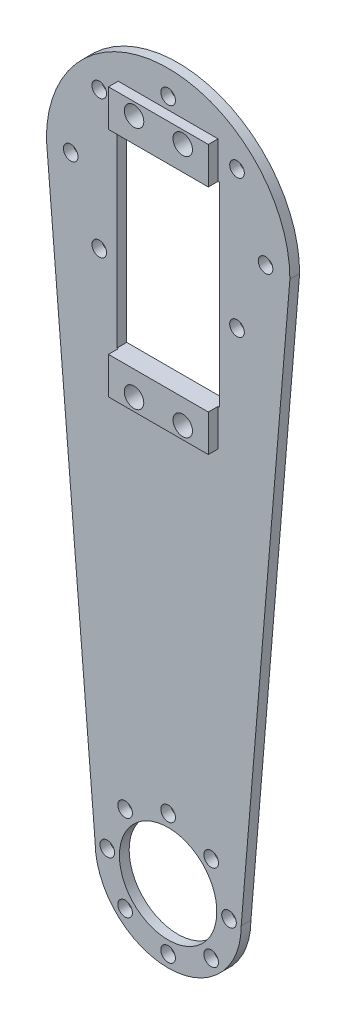
from build123d import *

# Parameters (mm, degrees)
SKETCH_1_W          = 20.5
SKETCH_1_H          = 15.141704846
SKETCH_1_R          = 2
EXTRUDE_1_DEPTH     = 29
SKETCH_2_W          = 20.5
SKETCH_2_H          = 70.283409692
EXTRUDE_2_DEPTH     = 3
SKETCH_3_W          = 20.5
SKETCH_3_H          = 7.570852423
CUT_EXTRUDE_1_DEPTH = 49.621002864
SKETCH_5_R          = 2.5
EXTRUDE_3_DEPTH     = 10
CUT_EXTRUDE_2_REACH = 75.297
SKETCH_8_R          = 1.6
SKETCH_9_W          = 20.5
SKETCH_9_H          = 55.141704846
CUT_EXTRUDE_3_DEPTH = 30
SKETCH_11_R         = 2.5
CUT_EXTRUDE_4_DEPTH = 10
SKETCH_12_W         = 21
SKETCH_12_H         = 40
SKETCH_12_R         = 2
EXTRUDE_5_DEPTH     = 2
SKETCH_13_R         = 10
CUT_EXTRUDE_5_DEPTH = 2
SKETCH_14_R         = 1.5
CUT_EXTRUDE_6_DEPTH = 128.538229563


with BuildPart() as part:
    # 草图1 → 凸台-拉伸1 (new body)
    # profile 1 of 3: a face of its own
    with BuildSketch(Plane.XY):
        with BuildLine():
            Line((-10.25, 35.141704846), (-10.25, 20))
            Line((-10.25, 20), (-5, 20))
            Line((-5, 20), (-5, 23))
            ThreePointArc((-5, 23), (-6.414213562, 26.414213562), (-3, 25))
            Line((-3, 25), (3, 25))
            ThreePointArc((3, 25), (5, 27), (7, 25))
            ThreePointArc((7, 25), (6.414213562, 23.585786438), (5, 23))
            Line((5, 23), (5, 20))
            Line((5, 20), (10.25, 20))
            Line((10.25, 20), (10.25, 35.141704846))
            Line((10.25, 35.141704846), (-10.25, 35.141704846))
        make_face()
    # profile 2 of 3: a face of its own
    with BuildSketch(Plane.XY):
        with Locations((0, -27.570852423)):
            Rectangle(SKETCH_1_W, SKETCH_1_H)
        with Locations(Location((-5, -25, 0), (0, 0, 180))):
            Circle(SKETCH_1_R, mode=Mode.SUBTRACT)
        with Locations(Location((5, -25, 0), (0, 0, 180))):
            Circle(SKETCH_1_R, mode=Mode.SUBTRACT)
    # profile 3 of 3: a face of its own
    with BuildSketch(Plane.XY):
        with BuildLine():
            Line((-5, 23), (-5, 20))
            Line((-5, 20), (5, 20))
            Line((5, 20), (5, 23))
            ThreePointArc((5, 23), (3.585786438, 23.585786438), (3, 25))
            Line((3, 25), (-3, 25))
            ThreePointArc((-3, 25), (-3.585786438, 23.585786438), (-5, 23))
        make_face()
    extrude(amount=EXTRUDE_1_DEPTH)

    # 草图2 → 凸台-拉伸2 (add)
    with BuildSketch(Plane.XY.offset(29)):
        Rectangle(SKETCH_2_W, SKETCH_2_H)
    extrude(amount=EXTRUDE_2_DEPTH)

    # 草图3 → 切除-拉伸1 (cut, through all)
    with BuildSketch(Plane(origin=(0, 0, 0), x_dir=(-1, 0, 0), z_dir=(0, 0, -1))):
        with Locations((0, -31.356278635)):
            Rectangle(SKETCH_3_W, SKETCH_3_H)
        with Locations((0, 31.356278635)):
            Rectangle(SKETCH_3_W, SKETCH_3_H)
    extrude(amount=-CUT_EXTRUDE_1_DEPTH, mode=Mode.SUBTRACT)

    # 草图5 → 凸台-拉伸3 (add)
    with BuildSketch(Plane.XZ.offset(27.570852423)):
        with Locations(Location((0, 2.5, 0), (0, 0, 270))):
            Circle(SKETCH_5_R)
    extrude(amount=EXTRUDE_3_DEPTH)

    # 草图8 → 切除-拉伸2 (cut, up to next)
    with BuildSketch(Plane(origin=(0, 27.570852423, 0), x_dir=(1, 0, 0), z_dir=(0, 1, 0)), mode=Mode.PRIVATE) as cut_extrude_2_sk1:
        with Locations(Location((0, -16.5, 0), (0, 0, 270))):
            Circle(SKETCH_8_R)
    cut_extrude_2_tool1 = extrude(cut_extrude_2_sk1.sketch, amount=-CUT_EXTRUDE_2_REACH, mode=Mode.PRIVATE) & part.part
    # 草图8 → 切除-拉伸2 (cut, up to next)
    with BuildSketch(Plane(origin=(0, 27.570852423, 0), x_dir=(1, 0, 0), z_dir=(0, 1, 0)), mode=Mode.PRIVATE) as cut_extrude_2_sk2:
        with Locations(Location((0, -26.5, 0), (0, 0, 270))):
            Circle(SKETCH_8_R)
    cut_extrude_2_tool2 = extrude(cut_extrude_2_sk2.sketch, amount=-CUT_EXTRUDE_2_REACH, mode=Mode.PRIVATE) & part.part
    add(cut_extrude_2_tool1.solids().sort_by_distance((0, 27.570852, 16.5))[0], mode=Mode.SUBTRACT)
    add(cut_extrude_2_tool2.solids().sort_by_distance((0, 27.570852, 26.5))[0], mode=Mode.SUBTRACT)

    # 草图9 → 切除-拉伸3 (cut)
    with BuildSketch(Plane.XY.offset(32)):
        Rectangle(SKETCH_9_W, SKETCH_9_H)
    extrude(amount=-CUT_EXTRUDE_3_DEPTH, mode=Mode.SUBTRACT)


with BuildPart() as cut_extrude_3_piece_1:
    # of the separate pieces the step leaves, piece 1, a body of its own (cut_extrude_3_pieces)
    add(part.part.solids().sort_by_distance((10.25, -20, 2))[0])

    # 草图11 → 切除-拉伸4 (cut)
    with BuildSketch(Plane.XZ.offset(37.570852423)):
        with Locations((0, 2.5)):
            Circle(SKETCH_11_R)
    extrude(amount=-CUT_EXTRUDE_4_DEPTH, mode=Mode.SUBTRACT)



with BuildPart() as cut_extrude_3_piece_2:
    # of the separate pieces the step leaves, piece 2, a body of its own (cut_extrude_3_pieces)
    add(part.part.solids().sort_by_distance((10.25, 20, 0))[0])


with BuildPart() as cut_extrude_3_piece_1_1:
    add(cut_extrude_3_piece_1.part)

    add(cut_extrude_3_piece_2.part)  # 凸台-拉伸5 merges 切除-拉伸3 piece 2
    # 草图12 → 凸台-拉伸5 (add)
    with BuildSketch(Plane(origin=(0, 0, 0), x_dir=(-1, 0, 0), z_dir=(0, 0, -1))):
        with BuildLine():
            Line((15, -110), (25, 10))
            ThreePointArc((25, 10), (0, 35), (-25, 10))
            Line((-25, 10), (-15, -110))
            ThreePointArc((-15, -110), (0, -125), (15, -110))
        make_face()
        Rectangle(SKETCH_12_W, SKETCH_12_H, mode=Mode.SUBTRACT)
        with Locations((-5, 25)):
            Circle(SKETCH_12_R, mode=Mode.SUBTRACT)
        with Locations((5, 25)):
            Circle(SKETCH_12_R, mode=Mode.SUBTRACT)
        with Locations(Location((5, -25, 0), (0, 0, 180))):
            Circle(SKETCH_12_R, mode=Mode.SUBTRACT)
        with Locations(Location((-5, -25, 0), (0, 0, 180))):
            Circle(SKETCH_12_R, mode=Mode.SUBTRACT)
    extrude(amount=EXTRUDE_5_DEPTH)

    # 草图13 → 切除-拉伸5 (cut)
    with BuildSketch(Plane(origin=(0, 0, -2), x_dir=(-1, 0, 0), z_dir=(0, 0, -1))):
        with Locations((0, -110)):
            Circle(SKETCH_13_R)
    extrude(amount=-CUT_EXTRUDE_5_DEPTH, mode=Mode.SUBTRACT)

    # 草图14 → 切除-拉伸6 (cut, through all)
    with BuildSketch(Plane(origin=(0, 0, -2), x_dir=(-1, 0, 0), z_dir=(0, 0, -1))):
        with Locations((-20, 10)):
            Circle(SKETCH_14_R)
        with Locations((-14.142135624, 24.142135624)):
            Circle(SKETCH_14_R)
        with Locations((0, 30)):
            Circle(SKETCH_14_R)
        with Locations((14.142135624, 24.142135624)):
            Circle(SKETCH_14_R)
        with Locations((20, 10)):
            Circle(SKETCH_14_R)
        with Locations((14.142135624, -4.142135624)):
            Circle(SKETCH_14_R)
        with Locations((-14.142135624, -4.142135624)):
            Circle(SKETCH_14_R)
        with Locations((0, -97.5)):
            Circle(SKETCH_14_R)
        with Locations((8.838834765, -101.161165235)):
            Circle(SKETCH_14_R)
        with Locations((12.5, -110)):
            Circle(SKETCH_14_R)
        with Locations((8.838834765, -118.838834765)):
            Circle(SKETCH_14_R)
        with Locations((0, -122.5)):
            Circle(SKETCH_14_R)
        with Locations((-8.838834765, -118.838834765)):
            Circle(SKETCH_14_R)
        with Locations((-12.5, -110)):
            Circle(SKETCH_14_R)
        with Locations((-8.838834765, -101.161165235)):
            Circle(SKETCH_14_R)
    extrude(amount=-CUT_EXTRUDE_6_DEPTH, mode=Mode.SUBTRACT)


solid = cut_extrude_3_piece_1_1.part
